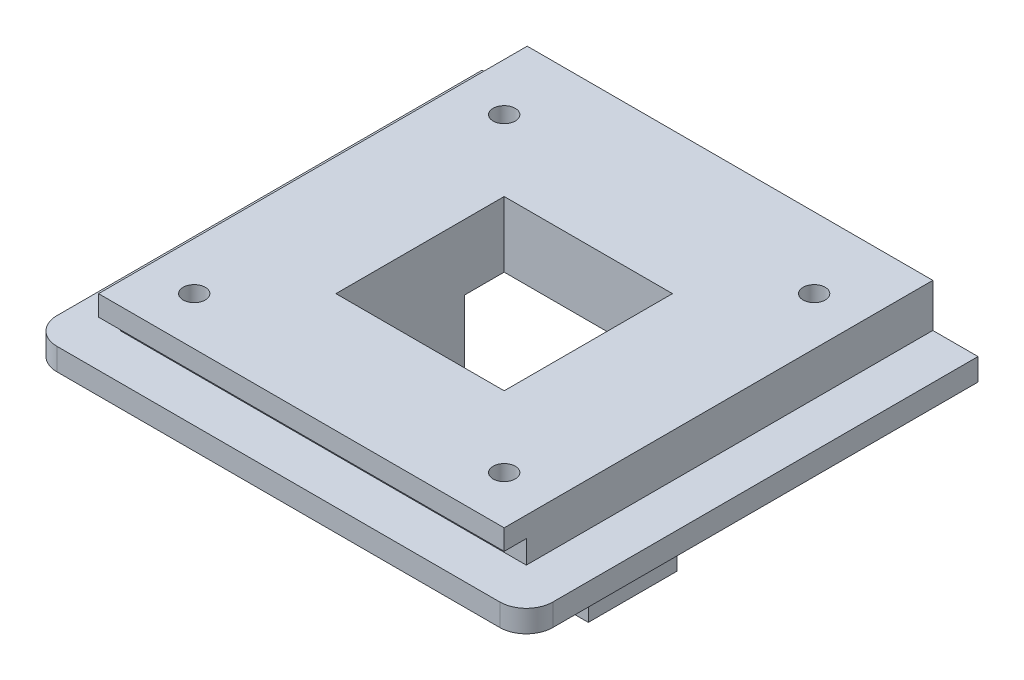
from build123d import *

# Parameters (mm, degrees)
SKETCH1_W                        = 46
SKETCH1_H                        = 46
BOSS_EXTRUDE1_DEPTH              = 2.5
SKETCH2_W                        = 46
SKETCH2_H                        = 48.5
BOSS_EXTRUDE2_DEPTH              = 2.5
SKETCH3_W                        = 56
SKETCH3_H                        = 51
BOSS_EXTRUDE3_DEPTH              = 2.5
SKETCH7_W                        = 5
SKETCH7_H                        = 10
BOSS_EXTRUDE6_DEPTH              = 15
CBORE_FOR_M2_5_SHCS1_D           = 3.1
CBORE_FOR_M2_5_SHCS1_DEPTH       = 5
CBORE_FOR_M2_5_SHCS1_CBORE_D     = 5.5
CBORE_FOR_M2_5_SHCS1_CBORE_DEPTH = 3.5
CBORE_FOR_M2_5_SHCS1_TIP         = 0.931333959
SKETCH11_W                       = 19
SKETCH11_H                       = 19
CUT_EXTRUDE2_DEPTH               = 71.299359883
M3X0_5_TAPPED_HOLE1_D            = 2.5
FILLET1_R                        = 3
MOVE_FACE1_BY                    = 0.1
MOVE_FACE1_2_BY                  = 0.1
MOVE_FACE1_3_BY                  = 0.1
MOVE_FACE1_4_BY                  = 0.1
MOVE_FACE2_BY                    = 0.1
MOVE_FACE2_2_BY                  = 0.1
M2_5X0_45_TAPPED_HOLE1_D         = 2.05
M2_5X0_45_TAPPED_HOLE1_DEPTH     = 5
M2_5X0_45_TAPPED_HOLE1_TIP       = 0.615882135
CBORE_FOR_M2_5_SHCS2_D           = 3.1
CBORE_FOR_M2_5_SHCS2_DEPTH       = 5
CBORE_FOR_M2_5_SHCS2_CBORE_D     = 5.5
CBORE_FOR_M2_5_SHCS2_CBORE_DEPTH = 3.5
CBORE_FOR_M2_5_SHCS2_TIP         = 0.931333959


with BuildPart() as part:
    # Sketch1 → Boss-Extrude1 (new body)
    with BuildSketch(Plane(origin=(0, 0, 0), x_dir=(1, 0, 0), z_dir=(0, 1, 0))):
        with Locations((23, 23)):
            Rectangle(SKETCH1_W, SKETCH1_H)
    extrude(amount=BOSS_EXTRUDE1_DEPTH)

    # Sketch2 → Boss-Extrude2 (add)
    with BuildSketch(Plane(origin=(0, 2.5, 0), x_dir=(1, 0, 0), z_dir=(0, 1, 0))):
        with Locations((23, 21.75)):
            Rectangle(SKETCH2_W, SKETCH2_H)
    extrude(amount=BOSS_EXTRUDE2_DEPTH)

    # Sketch3 → Boss-Extrude3 (add)
    with BuildSketch(Plane.XZ):
        with Locations((23, -20.5)):
            Rectangle(SKETCH3_W, SKETCH3_H)
    extrude(amount=BOSS_EXTRUDE3_DEPTH)

    # Sketch7 → Boss-Extrude6 (add)
    with BuildSketch(Plane.XZ.offset(2.5)):
        with Locations((11, -20.5)):
            Rectangle(SKETCH7_W, SKETCH7_H)
        with Locations((35, -20.5)):
            Rectangle(SKETCH7_W, SKETCH7_H)
    extrude(amount=BOSS_EXTRUDE6_DEPTH)

    # CBORE for M2.5 SHCS1
    with Locations(Plane.ZY.offset(-8.5)):
        with Locations((-20.5, -10.5)):
            CounterBoreHole(CBORE_FOR_M2_5_SHCS1_D / 2, CBORE_FOR_M2_5_SHCS1_CBORE_D / 2, CBORE_FOR_M2_5_SHCS1_CBORE_DEPTH, depth=CBORE_FOR_M2_5_SHCS1_DEPTH)
            with Locations((0, 0, -(CBORE_FOR_M2_5_SHCS1_DEPTH + CBORE_FOR_M2_5_SHCS1_TIP / 2))):  # 118° drill point
                Cone(0, CBORE_FOR_M2_5_SHCS1_D / 2, CBORE_FOR_M2_5_SHCS1_TIP, mode=Mode.SUBTRACT)

    # Sketch11 → Cut-Extrude2 (cut, through all)
    with BuildSketch(Plane.XZ.offset(2.5)):
        with Locations((23, -20.5)):
            Rectangle(SKETCH11_W, SKETCH11_H)
    extrude(amount=-CUT_EXTRUDE2_DEPTH, mode=Mode.SUBTRACT)

    # M3x0.5 Tapped Hole1 (through all)
    with Locations(Plane(origin=(0, 5, 0), x_dir=(1, 0, 0), z_dir=(0, 1, 0))):
        with Locations((5.5, 38), (40.5, 38), (40.5, 3), (5.5, 3)):
            Hole(M3X0_5_TAPPED_HOLE1_D / 2)

    # Fillet1
    fillet1_edges = [part.edges().sort_by_distance(p)[0] for p in [
        (51, -1.25, 5),
        (-5, -1.25, 5),
    ]]
    fillet(fillet1_edges, radius=FILLET1_R)

    # Move Face1: a face moved inward by 0.1
    extrude(part.faces().sort_by_distance((23, 5, -9.625))[0], amount=MOVE_FACE1_BY, dir=(0, -1, 0), mode=Mode.SUBTRACT)

    # Move Face1 2: a face moved inward by 0.1
    extrude(part.faces().sort_by_distance((23, 2.5, 1.25))[0], amount=MOVE_FACE1_2_BY, dir=(0, 1, 0), mode=Mode.SUBTRACT)

    # Move Face1 3: a face moved inward by 0.1
    extrude(part.faces().sort_by_distance((23, 3.75, 2.5))[0], amount=MOVE_FACE1_3_BY, dir=(0, 0, -1), mode=Mode.SUBTRACT)

    # Move Face1 4: a face moved inward by 0.1
    extrude(part.faces().sort_by_distance((23, 1.25, 0))[0], amount=MOVE_FACE1_4_BY, dir=(0, 0, -1), mode=Mode.SUBTRACT)

    # Move Face2: a face moved inward by 0.1
    extrude(part.faces().sort_by_distance((0, 2.482407006, -22.446731119))[0], amount=MOVE_FACE2_BY, dir=(1, 0, 0), mode=Mode.SUBTRACT)

    # Move Face2 2: a face moved inward by 0.1
    extrude(part.faces().sort_by_distance((46, 2.482407006, -22.446731119))[0], amount=MOVE_FACE2_2_BY, dir=(-1, 0, 0), mode=Mode.SUBTRACT)

    # M2.5x0.45 Tapped Hole1
    with Locations(Plane(origin=(0, 0, -46), x_dir=(-1, 0, 0), z_dir=(0, 0, -1))):
        with Locations((-36, 1.9), (-10, 1.9)):
            Hole(M2_5X0_45_TAPPED_HOLE1_D / 2, depth=M2_5X0_45_TAPPED_HOLE1_DEPTH)
            with Locations((0, 0, -(M2_5X0_45_TAPPED_HOLE1_DEPTH + M2_5X0_45_TAPPED_HOLE1_TIP / 2))):  # 118° drill point
                Cone(0, M2_5X0_45_TAPPED_HOLE1_D / 2, M2_5X0_45_TAPPED_HOLE1_TIP, mode=Mode.SUBTRACT)

    # CBORE for M2.5 SHCS2
    with Locations(Plane(origin=(37.5, 0, 0), x_dir=(0, 0, -1), z_dir=(1, 0, 0))):
        with Locations((20.5, -10.5)):
            CounterBoreHole(CBORE_FOR_M2_5_SHCS2_D / 2, CBORE_FOR_M2_5_SHCS2_CBORE_D / 2, CBORE_FOR_M2_5_SHCS2_CBORE_DEPTH, depth=CBORE_FOR_M2_5_SHCS2_DEPTH)
            with Locations((0, 0, -(CBORE_FOR_M2_5_SHCS2_DEPTH + CBORE_FOR_M2_5_SHCS2_TIP / 2))):  # 118° drill point
                Cone(0, CBORE_FOR_M2_5_SHCS2_D / 2, CBORE_FOR_M2_5_SHCS2_TIP, mode=Mode.SUBTRACT)


solid = part.part
